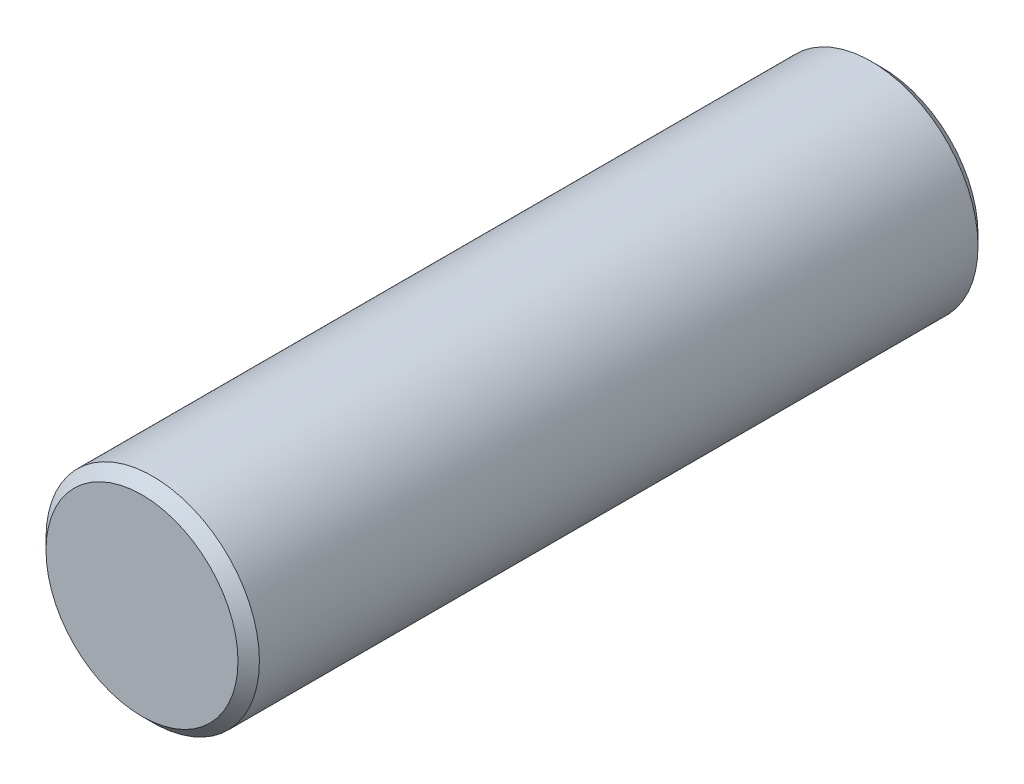
from build123d import *

# Parameters (mm, degrees)
SKETCH_1_R      = 1.99
EXTRUDE_1_DEPTH = 6.9
CHAMFER_1_SIZE  = 0.2


with BuildPart() as part:
    # 스케치1 → 보스-돌출1 (new, symmetric)
    with BuildSketch(Plane.XY):
        with Locations(Location((0, 0, 0), (0, 0, 180))):
            Circle(SKETCH_1_R)
    extrude(amount=EXTRUDE_1_DEPTH, both=True)

    # 모따기1
    chamfer_1_edges = [part.edges().sort_by_distance(p)[0] for p in [
        (1.99, 0, -6.9),
        (1.99, 0, 6.9),
    ]]
    chamfer(chamfer_1_edges, length=CHAMFER_1_SIZE)


solid = part.part
